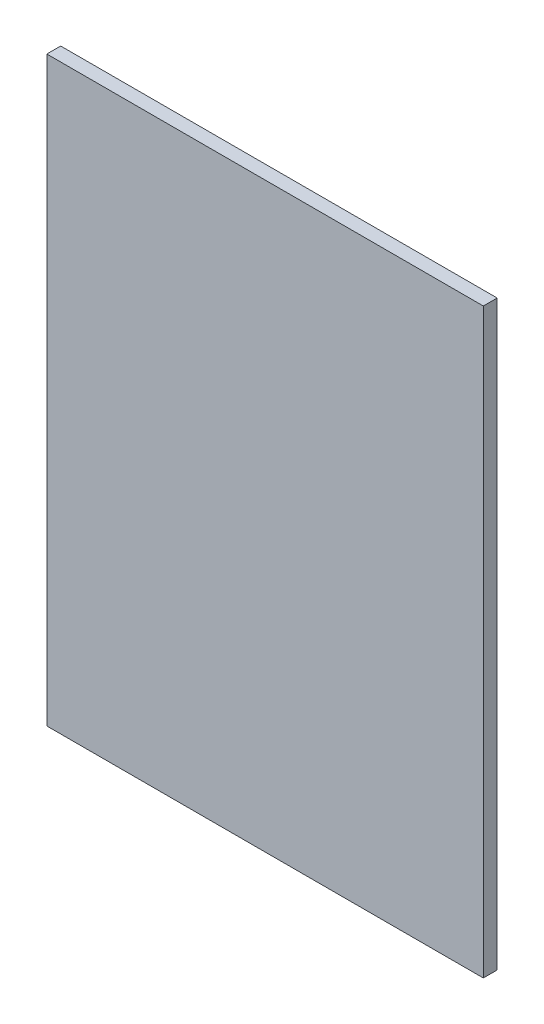
from build123d import *

# Parameters (mm, degrees)
CROQUIS1_W              = 150
CROQUIS1_H              = 200
SALIENTE_EXTRUIR1_DEPTH = 4.7625


with BuildPart() as part:
    # Croquis1 → Saliente-Extruir1 (new body)
    with BuildSketch(Plane.XY):
        with Locations((75, 100)):
            Rectangle(CROQUIS1_W, CROQUIS1_H)
    extrude(amount=SALIENTE_EXTRUIR1_DEPTH)


solid = part.part
